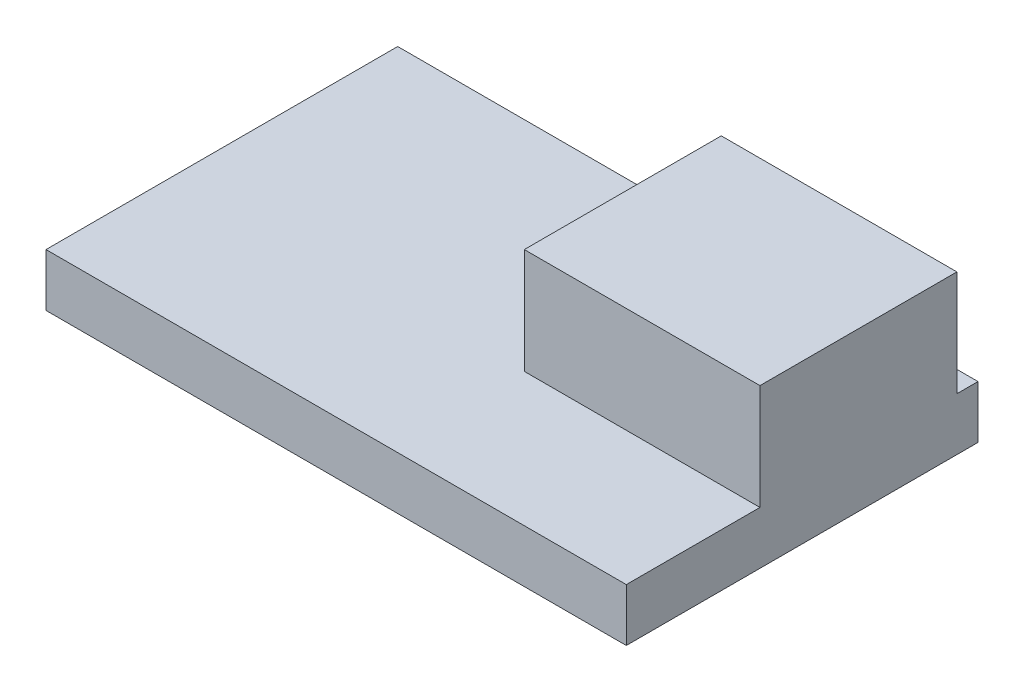
from build123d import *

# Parameters (mm, degrees)
SKETCH1_W           = 165
SKETCH1_H           = 100
BOSS_EXTRUDE1_DEPTH = 45
CUT_EXTRUDE1_DEPTH  = 30


with BuildPart() as part:
    # Sketch1 → Boss-Extrude1 (new body)
    with BuildSketch(Plane(origin=(0, 0, 0), x_dir=(1, 0, 0), z_dir=(0, 1, 0))):
        with Locations((59.720888355, -26.62665066)):
            Rectangle(SKETCH1_W, SKETCH1_H)
    extrude(amount=BOSS_EXTRUDE1_DEPTH)

    # Sketch2 → Cut-Extrude1 (cut)
    with BuildSketch(Plane(origin=(0, 45, 0), x_dir=(1, 0, 0), z_dir=(0, 1, 0))):
        Polygon((75.220888355, -38.62665066), (75.220888355, 17.37334934), (142.220888355, 17.37334934), (142.220888355, 23.37334934), (-22.779111645, 23.37334934), (-22.779111645, -76.62665066), (142.220888355, -76.62665066), (142.220888355, -38.62665066), align=None)
    extrude(amount=-CUT_EXTRUDE1_DEPTH, mode=Mode.SUBTRACT)


solid = part.part
